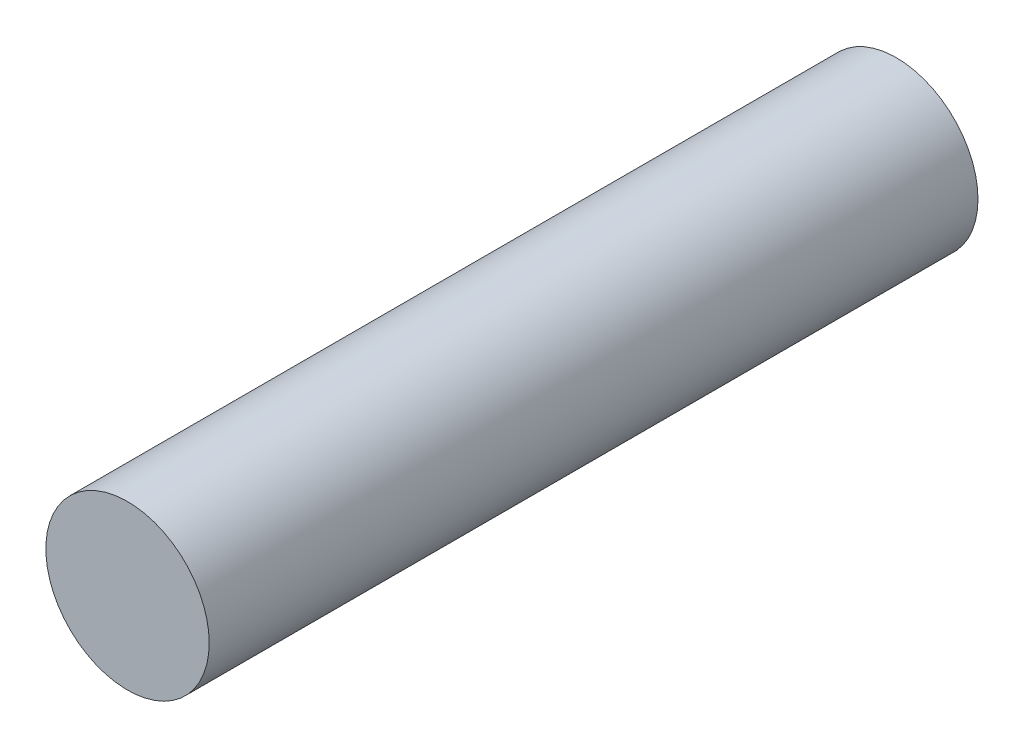
from build123d import *

# Parameters (mm, degrees)
SKETCH_1_R      = 1.7
EXTRUDE_1_DEPTH = 16


with BuildPart() as part:
    # 草图1 → 拉伸1 (new body)
    with BuildSketch(Plane.XY):
        Circle(SKETCH_1_R)
    extrude(amount=EXTRUDE_1_DEPTH)


solid = part.part
